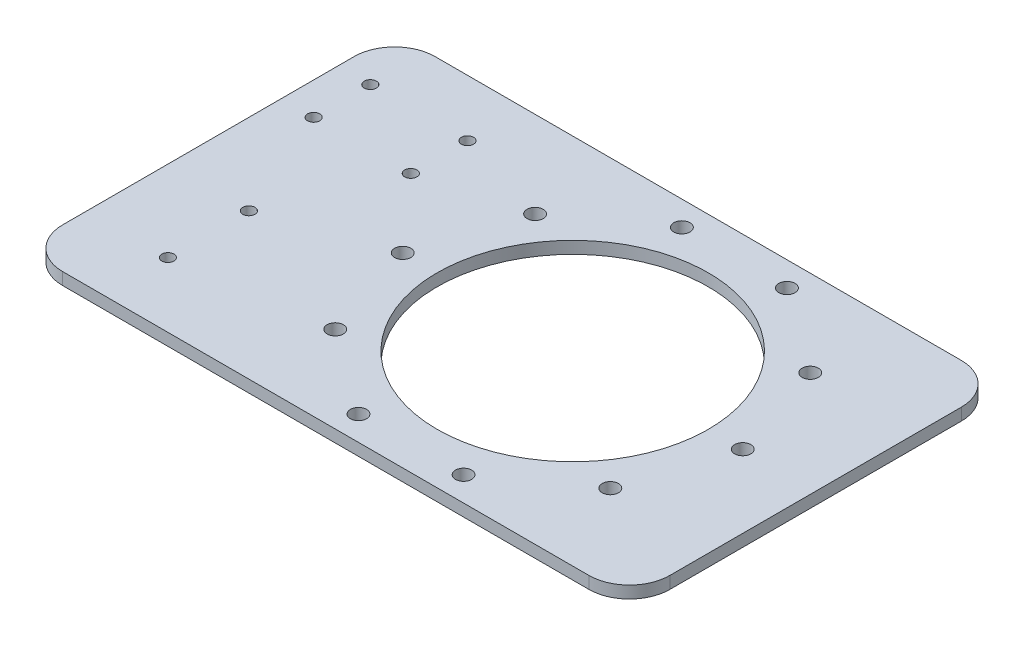
from build123d import *

# Parameters (mm, degrees)
SKETCH_1_W               = 150
SKETCH_1_H               = 92
SKETCH_1_R               = 33.5
EXTRUDE_1_DEPTH          = 3
CUT_EXTRUDE_1_REACH      = 90.034
SKETCH_2_R               = 2
PATTERN_CIRCULAR_1_COUNT = 10
SKETCH_3_R               = 1.5
CUT_EXTRUDE_2_DEPTH      = 3
FILLET_1_R               = 10


with BuildPart() as part:
    # 草圖1 → 填料-伸長1 (new body)
    with BuildSketch(Plane(origin=(0, 0, 0), x_dir=(1, 0, 0), z_dir=(0, 1, 0))):
        Rectangle(SKETCH_1_W, SKETCH_1_H)
        with Locations(Location((15, 0, 0), (0, 0, 270))):
            Circle(SKETCH_1_R, mode=Mode.SUBTRACT)
    extrude(amount=EXTRUDE_1_DEPTH)

    # 草圖2 → 除料-伸長1 (cut, up to next)
    with BuildSketch(Plane(origin=(0, 3, 0), x_dir=(1, 0, 0), z_dir=(0, 1, 0)), mode=Mode.PRIVATE) as cut_extrude_1_sk1:
        with Locations(Location((57, 0, 0), (0, 0, 270))):
            Circle(SKETCH_2_R)
    cut_extrude_1_tool1 = extrude(cut_extrude_1_sk1.sketch, amount=-CUT_EXTRUDE_1_REACH, mode=Mode.PRIVATE) & part.part
    cut_extrude_1 = cut_extrude_1_tool1.solids().sort_by_distance((57, 3, 0))[0]
    add(cut_extrude_1, mode=Mode.SUBTRACT)

    # 環狀複製排列1: 除料-伸長1 ×10 about axis
    pattern_circular_1_axis = Axis((15, 0, 0), (0, 1, 0))
    for i in range(1, PATTERN_CIRCULAR_1_COUNT):
        add(cut_extrude_1.rotate(pattern_circular_1_axis, i * 360 / PATTERN_CIRCULAR_1_COUNT), mode=Mode.SUBTRACT)

    # 草圖3 → 除料-伸長2 (cut)
    with BuildSketch(Plane(origin=(0, 3, 0), x_dir=(1, 0, 0), z_dir=(0, 1, 0))):
        with Locations(Location((-67, 32, 0), (0, 0, 270))):
            Circle(SKETCH_3_R)
        with Locations(Location((-67, 18, 0), (0, 0, 270))):
            Circle(SKETCH_3_R)
        with Locations(Location((-43, 18, 0), (0, 0, 90))):
            Circle(SKETCH_3_R)
        with Locations(Location((-43, 32, 0), (0, 0, 90))):
            Circle(SKETCH_3_R)
        with Locations(Location((-55, -10, 0), (0, 0, 270))):
            Circle(SKETCH_3_R)
        with Locations(Location((-55, -30, 0), (0, 0, 270))):
            Circle(SKETCH_3_R)
    extrude(amount=-CUT_EXTRUDE_2_DEPTH, mode=Mode.SUBTRACT)

    # 圓角1
    fillet_1_edges = [part.edges().sort_by_distance(p)[0] for p in [
        (75, 1.5, 46),
        (-75, 1.5, 46),
        (-75, 1.5, -46),
        (75, 1.5, -46),
    ]]
    fillet(fillet_1_edges, radius=FILLET_1_R)


solid = part.part
